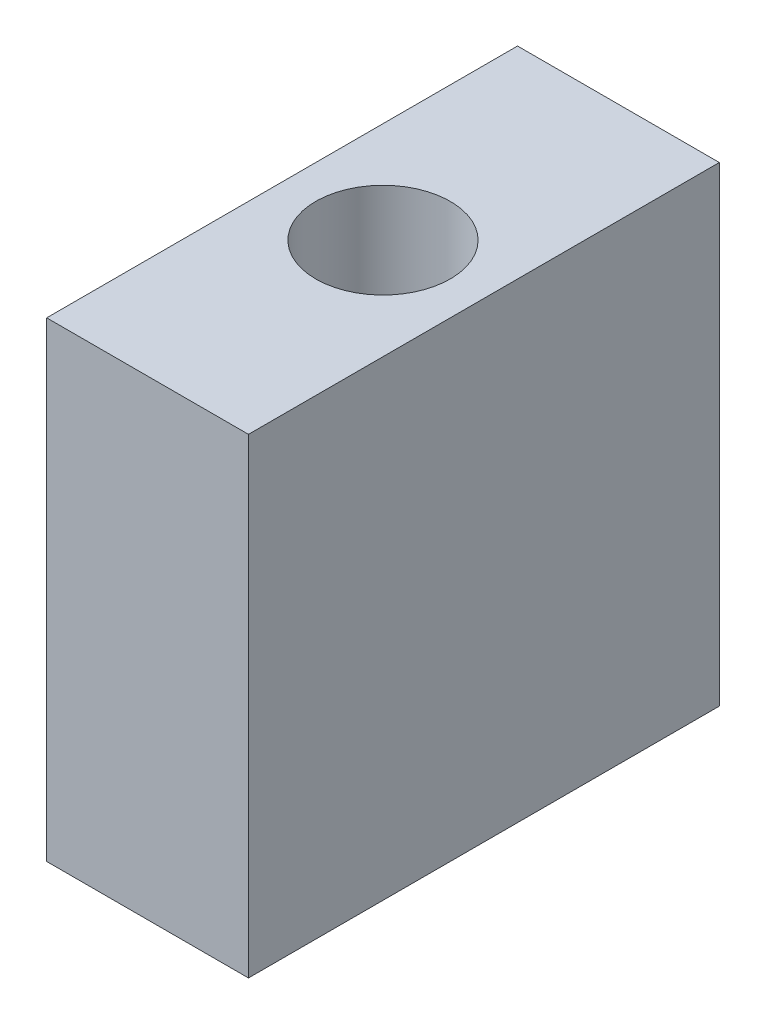
from build123d import *

# Parameters (mm, degrees)
SKETCH1_W           = 3
SKETCH1_H           = 7
SKETCH1_R           = 1
BOSS_EXTRUDE1_DEPTH = 7


with BuildPart() as part:
    # Sketch1 → Boss-Extrude1 (new body)
    with BuildSketch(Plane(origin=(0, 0, 0), x_dir=(1, 0, 0), z_dir=(0, 1, 0))):
        Rectangle(SKETCH1_W, SKETCH1_H)
        with Locations(Location((0, 0, 0), (0, 0, 270))):
            Circle(SKETCH1_R, mode=Mode.SUBTRACT)
    extrude(amount=BOSS_EXTRUDE1_DEPTH)


solid = part.part
